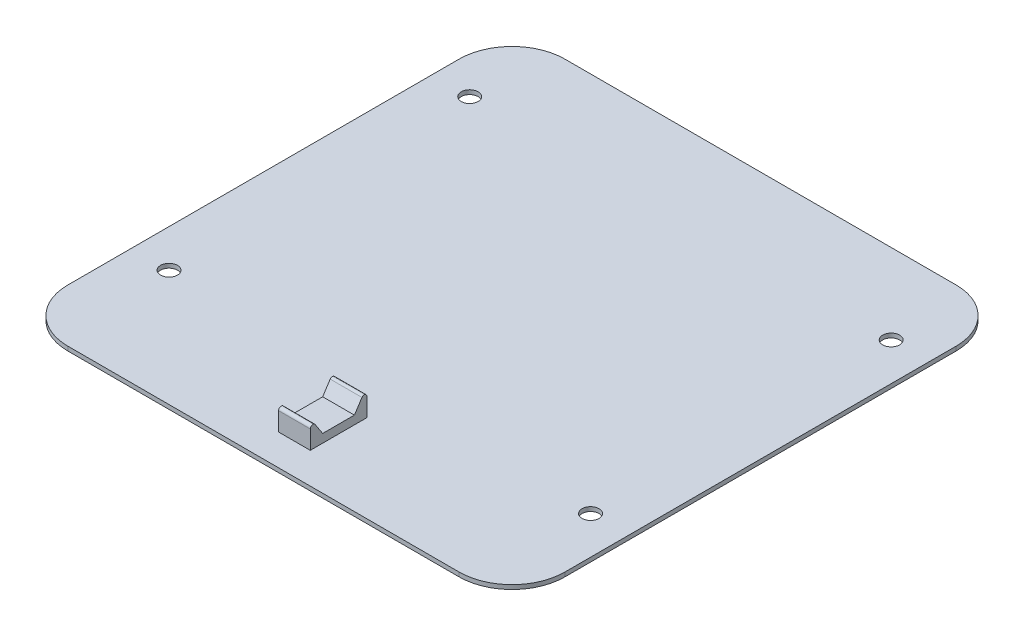
from build123d import *

# Parameters (mm, degrees)
SKETCH_1_W             = 94
SKETCH_1_H             = 94
EXTRUDE_1088_DEPTH     = 0.8
FILLET_1_R             = 10
CUT_EXTRUDE_1446_REACH = 68.473
SKETCH_2_R             = 1.6
EXTRUDE_1491_DEPTH     = 3
FILLET_2_R             = 0.5


with BuildPart() as part:
    # 草图1 → Extrude 1088 (new body)
    with BuildSketch(Plane(origin=(0, 0, 0), x_dir=(1, 0, 0), z_dir=(0, 1, 0))):
        Rectangle(SKETCH_1_W, SKETCH_1_H)
    extrude(amount=EXTRUDE_1088_DEPTH)

    # 圆角1
    fillet_1_edges = [part.edges().sort_by_distance(p)[0] for p in [
        (47, 0.4, 47),
        (-47, 0.4, 47),
        (-47, 0.4, -47),
        (47, 0.4, -47),
    ]]
    fillet(fillet_1_edges, radius=FILLET_1_R)

    # 草图2 → Cut-Extrude 1446 (cut, up to next)
    with BuildSketch(Plane(origin=(0, 0.8, 0), x_dir=(1, 0, 0), z_dir=(0, 1, 0)), mode=Mode.PRIVATE) as cut_extrude_1446_sk1:
        with Locations(Location((-39.85, 31.85, 0), (0, 0, 270))):
            Circle(SKETCH_2_R)
    cut_extrude_1446_tool1 = extrude(cut_extrude_1446_sk1.sketch, amount=-CUT_EXTRUDE_1446_REACH, mode=Mode.PRIVATE) & part.part
    # 草图2 → Cut-Extrude 1446 (cut, up to next)
    with BuildSketch(Plane(origin=(0, 0.8, 0), x_dir=(1, 0, 0), z_dir=(0, 1, 0)), mode=Mode.PRIVATE) as cut_extrude_1446_sk2:
        with Locations(Location((39.85, 31.85, 0), (0, 0, 270))):
            Circle(SKETCH_2_R)
    cut_extrude_1446_tool2 = extrude(cut_extrude_1446_sk2.sketch, amount=-CUT_EXTRUDE_1446_REACH, mode=Mode.PRIVATE) & part.part
    # 草图2 → Cut-Extrude 1446 (cut, up to next)
    with BuildSketch(Plane(origin=(0, 0.8, 0), x_dir=(1, 0, 0), z_dir=(0, 1, 0)), mode=Mode.PRIVATE) as cut_extrude_1446_sk3:
        with Locations(Location((39.85, -25, 0), (0, 0, 270))):
            Circle(SKETCH_2_R)
    cut_extrude_1446_tool3 = extrude(cut_extrude_1446_sk3.sketch, amount=-CUT_EXTRUDE_1446_REACH, mode=Mode.PRIVATE) & part.part
    # 草图2 → Cut-Extrude 1446 (cut, up to next)
    with BuildSketch(Plane(origin=(0, 0.8, 0), x_dir=(1, 0, 0), z_dir=(0, 1, 0)), mode=Mode.PRIVATE) as cut_extrude_1446_sk4:
        with Locations(Location((-39.85, -25, 0), (0, 0, 270))):
            Circle(SKETCH_2_R)
    cut_extrude_1446_tool4 = extrude(cut_extrude_1446_sk4.sketch, amount=-CUT_EXTRUDE_1446_REACH, mode=Mode.PRIVATE) & part.part
    add(cut_extrude_1446_tool1.solids().sort_by_distance((-39.85, 0.8, -31.85))[0], mode=Mode.SUBTRACT)
    add(cut_extrude_1446_tool2.solids().sort_by_distance((39.85, 0.8, -31.85))[0], mode=Mode.SUBTRACT)
    add(cut_extrude_1446_tool3.solids().sort_by_distance((39.85, 0.8, 25))[0], mode=Mode.SUBTRACT)
    add(cut_extrude_1446_tool4.solids().sort_by_distance((-39.85, 0.8, 25))[0], mode=Mode.SUBTRACT)

    # 草图4 → Extrude 1491 (add, symmetric)
    with BuildSketch(Plane(origin=(0, 0, 0), x_dir=(0, 0, -1), z_dir=(1, 0, 0))):
        Polygon((-41.145, 0.8), (-30.455, 0.8), (-30.455, 5.98), (-32.8, 2.4), (-38.8, 2.4), (-41.145, 5.98), align=None)
    extrude(amount=EXTRUDE_1491_DEPTH, both=True)

    # 圆角2
    fillet_2_edges = [part.edges().sort_by_distance(p)[0] for p in [
        (0, 5.98, 41.145),
        (0, 5.98, 30.455),
    ]]
    fillet(fillet_2_edges, radius=FILLET_2_R)


solid = part.part
